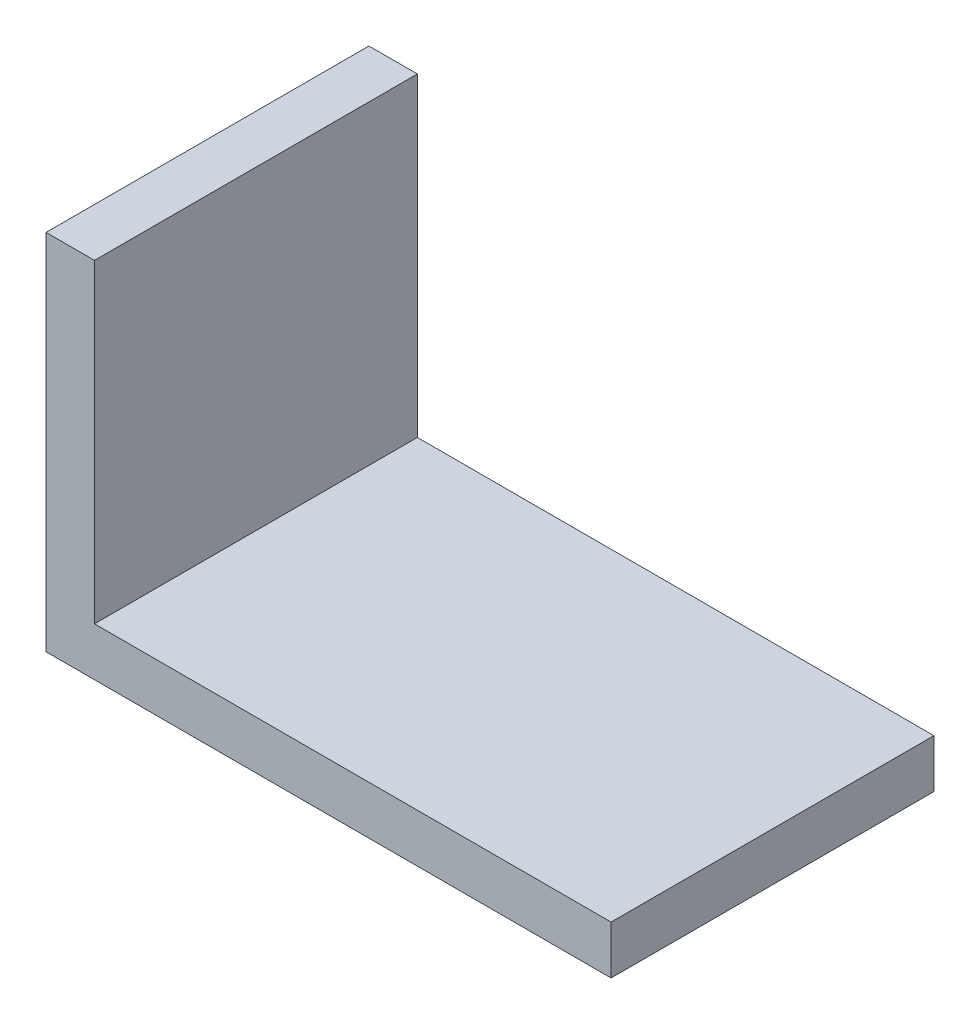
from build123d import *

# Parameters (mm, degrees)
EXTRUDE_1_DEPTH = 40


with BuildPart() as part:
    # 草图8 → 凸台-拉伸1 (new, symmetric)
    with BuildSketch(Plane.XY):
        Polygon((0, 0), (140, 0), (140, 12), (12, 12), (12, 90), (0, 90), align=None)
    extrude(amount=EXTRUDE_1_DEPTH, both=True)


solid = part.part
